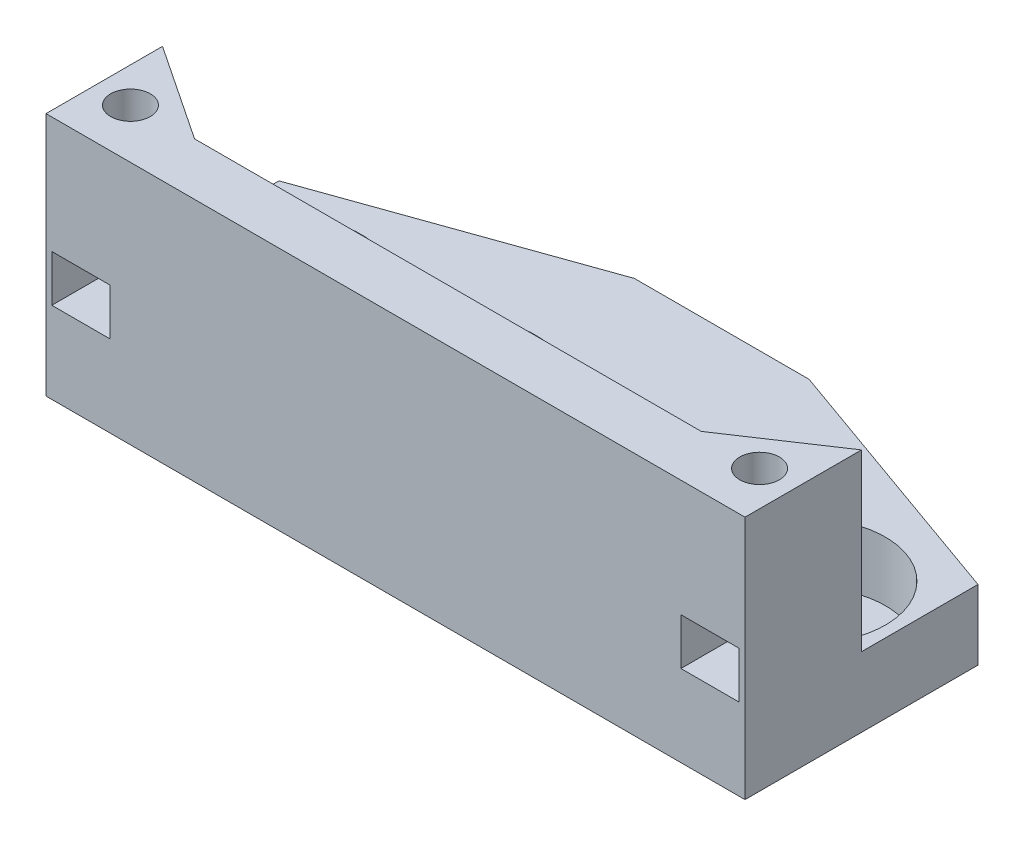
from build123d import *

# Parameters (mm, degrees)
BOSS_EXTRUDE1_DEPTH = 6
BOSS_EXTRUDE3_DEPTH = 15
SKETCH4_R           = 1.7
CUT_EXTRUDE1_DEPTH  = 10
CUT_EXTRUDE2_START  = -10
CUT_EXTRUDE2_DEPTH  = 4
SKETCH2_4_R         = 6.55
CUT_EXTRUDE3_DEPTH  = 5.1
SKETCH2_5_R         = 2.15
CUT_EXTRUDE4_DEPTH  = 68.88961629


with BuildPart() as part:
    # Sketch1 → Boss-Extrude1 (new body)
    with BuildSketch(Plane(origin=(0, 0, 0), x_dir=(1, 0, 0), z_dir=(0, 1, 0))):
        Polygon((0, 0), (60, 0), (60, 20), (37.5, 28), (22.5, 28), (0, 20), align=None)
    extrude(amount=BOSS_EXTRUDE1_DEPTH)

    # Sketch3 → Boss-Extrude3 (add)
    with BuildSketch(Plane(origin=(0, 6, 0), x_dir=(1, 0, 0), z_dir=(0, 1, 0))):
        Polygon((0, 10), (0, 0), (60, 0), (60, 10), (51.75, 4.5), (8.25, 4.5), align=None)
    extrude(amount=BOSS_EXTRUDE3_DEPTH)

    # Sketch4 → Cut-Extrude1 (cut)
    with BuildSketch(Plane(origin=(0, 21, 0), x_dir=(1, 0, 0), z_dir=(0, 1, 0))):
        with Locations((3, 4.25)):
            Circle(SKETCH4_R)
        with Locations((57, 4.25)):
            Circle(SKETCH4_R)
    extrude(amount=-CUT_EXTRUDE1_DEPTH, mode=Mode.SUBTRACT)

    # Sketch6 → Cut-Extrude2 (cut)
    with BuildSketch(Plane(origin=(0, 21, 0), x_dir=(1, 0, 0), z_dir=(0, 1, 0)).offset(CUT_EXTRUDE2_START)):
        Polygon((54.5, 0), (59.5, 0), (59.5, 5.693375673), (57, 7.136751346), (54.5, 5.693375673), align=None)
        Polygon((5.5, 0), (5.5, 5.693375673), (3, 7.136751346), (0.5, 5.693375673), (0.5, 0), align=None)
    extrude(amount=-CUT_EXTRUDE2_DEPTH, mode=Mode.SUBTRACT)

    # Sketch2<4> → Cut-Extrude3 (cut)
    with BuildSketch(Plane(origin=(0, 6, 0), x_dir=(1, 0, 0), z_dir=(0, 1, 0))):
        with Locations((22.5, 13)):
            Circle(SKETCH2_4_R)
        with Locations((37.5, 13)):
            Circle(SKETCH2_4_R)
        with Locations((7.5, 13)):
            Circle(SKETCH2_4_R)
        with Locations((52.5, 13)):
            Circle(SKETCH2_4_R)
    extrude(amount=-CUT_EXTRUDE3_DEPTH, mode=Mode.SUBTRACT)

    # Sketch2<5> → Cut-Extrude4 (cut, through all)
    with BuildSketch(Plane(origin=(0, 6, 0), x_dir=(1, 0, 0), z_dir=(0, 1, 0))):
        with Locations((37.5, 13)):
            Circle(SKETCH2_5_R)
        with Locations((22.5, 13)):
            Circle(SKETCH2_5_R)
        with Locations((7.5, 13)):
            Circle(SKETCH2_5_R)
        with Locations((52.5, 13)):
            Circle(SKETCH2_5_R)
    extrude(amount=-CUT_EXTRUDE4_DEPTH, mode=Mode.SUBTRACT)


solid = part.part
